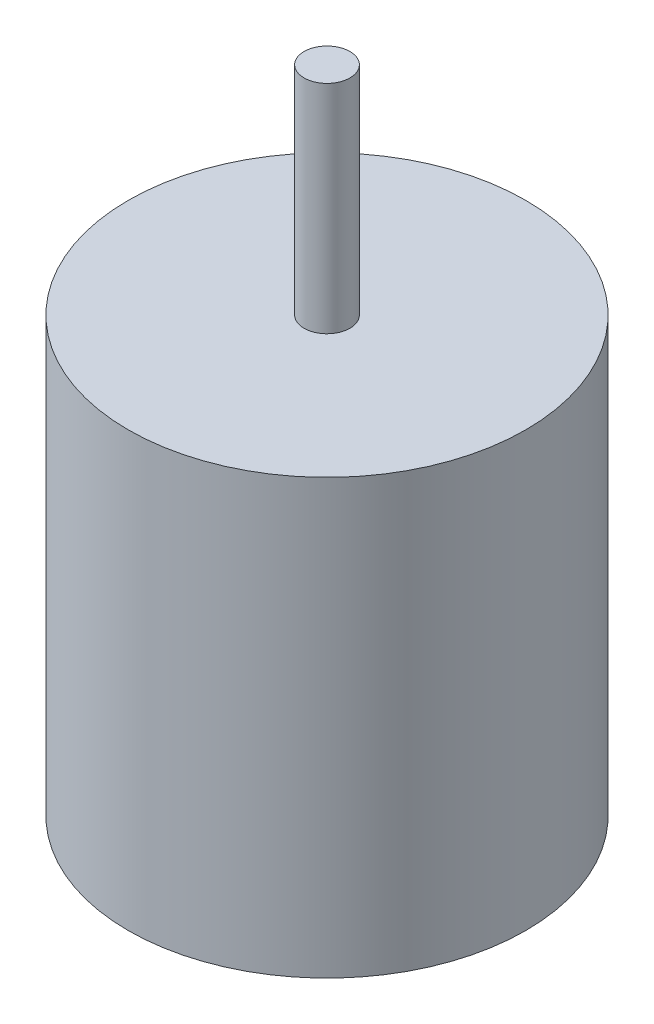
from build123d import *

# Parameters (mm, degrees)
SKETCH1_R           = 13.75
BOSS_EXTRUDE1_DEPTH = 30
SKETCH3_R           = 1.585
BOSS_EXTRUDE2_DEPTH = 15


with BuildPart() as part:
    # Sketch1 → Boss-Extrude1 (new body)
    with BuildSketch(Plane(origin=(0, 0, 0), x_dir=(1, 0, 0), z_dir=(0, 1, 0))):
        with Locations(Location((0, 0, 0), (0, 0, 270))):
            Circle(SKETCH1_R)
    extrude(amount=BOSS_EXTRUDE1_DEPTH)

    # Sketch3 → Boss-Extrude2 (add)
    with BuildSketch(Plane(origin=(0, 30, 0), x_dir=(1, 0, 0), z_dir=(0, 1, 0))):
        with Locations(Location((0, 0, 0), (0, 0, 270))):
            Circle(SKETCH3_R)
    extrude(amount=BOSS_EXTRUDE2_DEPTH)


solid = part.part
